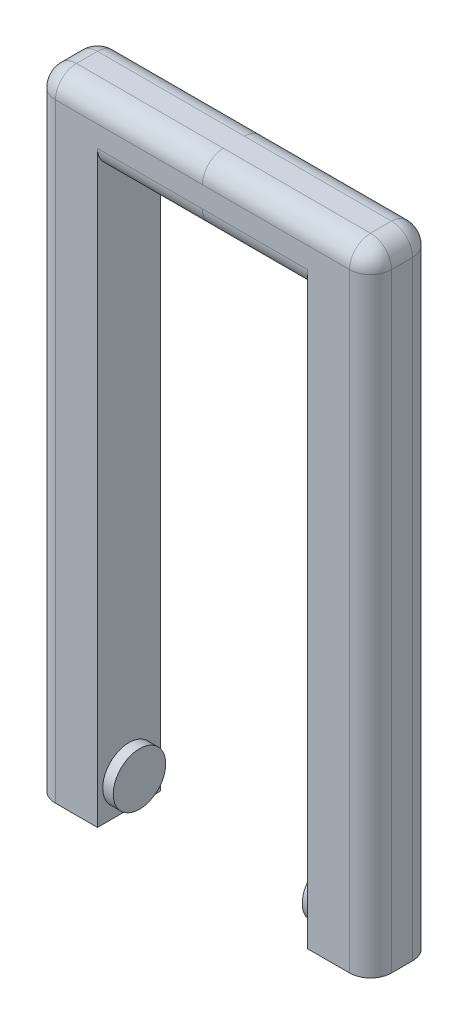
from build123d import *

# Parameters (mm, degrees)
BOSS_EXTRUDE1_DEPTH  = 3
SKETCH4_R            = 1.25
BOSS_EXTRUDE2_DEPTH  = 0.5
FILLET1_R            = 1
FILLET2_R            = 1
FILLET1_OF_MIRROR1_R = 1
FILLET2_OF_MIRROR1_R = 1


with BuildPart() as part:
    # Sketch3 → Boss-Extrude1 (new body)
    with BuildSketch(Plane.XY):
        Polygon((0, 30), (-8, 30), (-8, 18), (-8, 0), (-5, 0), (-5, 27), (0, 27), align=None)
    boss_extrude1 = extrude(amount=BOSS_EXTRUDE1_DEPTH)

    # Sketch4 → Boss-Extrude2 (add)
    with BuildSketch(Plane(origin=(-5, 0, 0), x_dir=(0, 0, -1), z_dir=(1, 0, 0))):
        with Locations(Location((-1.5, 1.5, 0), (0, 0, 270))):
            Circle(SKETCH4_R)
    boss_extrude2 = extrude(amount=BOSS_EXTRUDE2_DEPTH)

    # Fillet1
    fillet1_edges = [part.edges().sort_by_distance(p)[0] for p in [
        (-8, 15, 3),
        (-8, 15, 0),
    ]]
    fillet(fillet1_edges, radius=FILLET1_R)

    # Fillet2
    fillet2_edges = [part.edges().sort_by_distance(p)[0] for p in [
        (-8, 30, 1.5),
        (-2.5, 27, 3),
        (-7.707106781, 30, 2.707106781),
        (-7.707106781, 30, 0.292893219),
        (-2.5, 27, 0),
        (-3.5, 30, 3),
        (-3.5, 30, 0),
    ]]
    fillet(fillet2_edges, radius=FILLET2_R)

    # Mirror1: Boss-Extrude1, Boss-Extrude2 across plane
    add(boss_extrude1.mirror(Plane(origin=(0, 0, 0), x_dir=(0, 0, 1), z_dir=(1, 0, 0))))
    add(boss_extrude2.mirror(Plane(origin=(0, 0, 0), x_dir=(0, 0, 1), z_dir=(1, 0, 0))))

    # Fillet1 of Mirror1
    fillet1_of_mirror1_edges = [part.edges().sort_by_distance(p)[0] for p in [
        (8, 15, 3),
        (8, 15, 0),
    ]]
    fillet(fillet1_of_mirror1_edges, radius=FILLET1_OF_MIRROR1_R)

    # Fillet2 of Mirror1
    fillet2_of_mirror1_edges = [part.edges().sort_by_distance(p)[0] for p in [
        (8, 30, 1.5),
        (2.5, 27, 3),
        (7.707106781, 30, 2.707106781),
        (7.707106781, 30, 0.292893219),
        (2.5, 27, 0),
        (3.5, 30, 3),
        (3.5, 30, 0),
    ]]
    fillet(fillet2_of_mirror1_edges, radius=FILLET2_OF_MIRROR1_R)


solid = part.part
